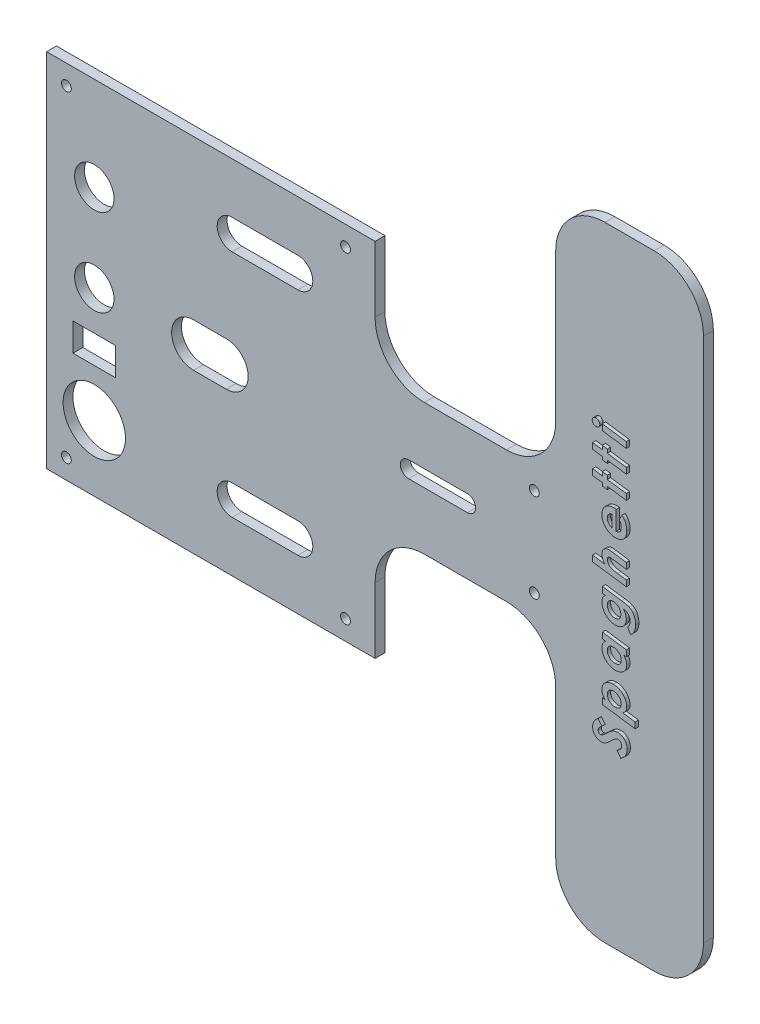
from build123d import *

# Parameters (mm, degrees)
SKETCH1_W           = 155
SKETCH1_H           = 110
BOSS_EXTRUDE1_DEPTH = 3
SKETCH2_R           = 9.5
SKETCH2_R_2         = 6
SKETCH2_R_3         = 1.5
SKETCH2_W           = 55
SKETCH2_H           = 35
SKETCH2_W_2         = 13
SKETCH2_H_2         = 8.5
CUT_EXTRUDE1_DEPTH  = 148
BOSS_EXTRUDE3_DEPTH = 3
FILLET1_R           = 15
CUT_EXTRUDE4_DEPTH  = 98
BOSS_EXTRUDE5_DEPTH = 1


with BuildPart() as part:
    # Sketch1 → Boss-Extrude1 (new body)
    with BuildSketch(Plane.XY):
        Rectangle(SKETCH1_W, SKETCH1_H)
    extrude(amount=BOSS_EXTRUDE1_DEPTH)

    # Sketch2 → Cut-Extrude1 (cut)
    with BuildSketch(Plane.XY.offset(3)):
        with Locations((-63, -35)):
            Circle(SKETCH2_R)
        with Locations((-63, 0)):
            Circle(SKETCH2_R_2)
        with Locations((-63, 26.5)):
            Circle(SKETCH2_R_2)
        with Locations((-71.5, 49)):
            Circle(SKETCH2_R_3)
        with Locations(Location((-71.5, -49, 0), (0, 0, 180))):
            Circle(SKETCH2_R_3)
        with Locations((71, 13.5)):
            Circle(SKETCH2_R_3)
        with Locations(Location((71, -13.5, 0), (0, 0, 180))):
            Circle(SKETCH2_R_3)
        with Locations((13.5, 49)):
            Circle(SKETCH2_R_3)
        with Locations(Location((13.5, -49, 0), (0, 0, 180))):
            Circle(SKETCH2_R_3)
        with Locations((50, -37.5)):
            Rectangle(SKETCH2_W, SKETCH2_H)
        with Locations((50, 37.5)):
            Rectangle(SKETCH2_W, SKETCH2_H)
        with Locations((-63.000064386, -16.25)):
            Rectangle(SKETCH2_W_2, SKETCH2_H_2)
        with BuildLine():
            Line((-21.019359149, 39.556644291), (-1.019359149, 39.556644291))
            ThreePointArc((-1.019359149, 39.556644291), (3.537285142, 35), (-1.019359149, 30.443355709))
            Line((-1.019359149, 30.443355709), (-21.019359149, 30.443355709))
            ThreePointArc((-21.019359149, 30.443355709), (-25.57600344, 35), (-21.019359149, 39.556644291))
        make_face()
        with BuildLine():
            Line((-21.019359149, -39.556644291), (-1.019359149, -39.556644291))
            ThreePointArc((-1.019359149, -39.556644291), (3.537285142, -35), (-1.019359149, -30.443355709))
            Line((-1.019359149, -30.443355709), (-21.019359149, -30.443355709))
            ThreePointArc((-21.019359149, -30.443355709), (-25.57600344, -35), (-21.019359149, -39.556644291))
        make_face()
        with BuildLine():
            Line((32.671689108, 2.5), (50.600051361, 2.5))
            ThreePointArc((50.600051361, 2.5), (53.100051361, 0), (50.600051361, -2.5))
            Line((50.600051361, -2.5), (32.671689108, -2.5))
            ThreePointArc((32.671689108, -2.5), (30.171689108, 0), (32.671689108, 2.5))
        make_face()
    extrude(amount=-CUT_EXTRUDE1_DEPTH, mode=Mode.SUBTRACT)

    # Sketch5 → Boss-Extrude3 (add)
    with BuildSketch(Plane.XY.offset(3)):
        Polygon((77.5, 20), (77.5, 95), (122.5, 95), (122.5, -95), (77.5, -95), (77.5, -20), align=None)
    extrude(amount=-BOSS_EXTRUDE3_DEPTH)

    # Fillet1
    fillet1_edges = [part.edges().sort_by_distance(p)[0] for p in [
        (77.5, -20, 1.5),
        (22.5, -20, 1.5),
        (77.5, -95, 1.5),
        (77.5, 95, 1.5),
        (122.5, 95, 1.5),
        (122.5, -95, 1.5),
        (77.5, 20, 1.5),
        (22.5, 20, 1.5),
    ]]
    fillet(fillet1_edges, radius=FILLET1_R)

    # Sketch9 → Cut-Extrude4 (cut)
    with BuildSketch(Plane.XY.offset(3)):
        with BuildLine():
            Line((-32.795860477, 6.651937297), (-22.795860477, 6.651937297))
            ThreePointArc((-22.795860477, 6.651937297), (-16.143923179, 0), (-22.795860477, -6.651937297))
            Line((-22.795860477, -6.651937297), (-32.795860477, -6.651937297))
            ThreePointArc((-32.795860477, -6.651937297), (-39.447797774, 0), (-32.795860477, 6.651937297))
        make_face()
    extrude(amount=-CUT_EXTRUDE4_DEPTH, mode=Mode.SUBTRACT)

    # Sketch8 → Boss-Extrude5 (add)
    # profile 1 of 10: a face of its own
    with BuildSketch(Plane.XY.offset(3)):
        with BuildLine():
            add(Edge.make_bspline(
                [(89.615384615, 41.935897436), (89.619798289, 42.012422402), (89.628468039, 42.162739898), (89.692001625, 42.379953596), (89.801735818, 42.577887154), (89.948996556, 42.754166087), (90.12609206, 42.901671261), (90.324190957, 43.013060386), (90.542415446, 43.07661064), (90.692714958, 43.085313209), (90.769230769, 43.08974359)],
                knots=[0, 0, 0, 0, 1.013694729, 1.991193998, 2.969534402, 3.993991339, 5.018448277, 6.008806002, 6.986305271, 8, 8, 8, 8], degree=3))
            add(Edge.make_bspline(
                [(90.769230769, 43.08974359), (90.845729295, 43.085282793), (90.995994855, 43.076520479), (91.21390075, 43.01357184), (91.410615409, 42.90097956), (91.587670945, 42.754337612), (91.734312893, 42.577282076), (91.846905173, 42.380567416), (91.909853812, 42.162661521), (91.918616126, 42.012395962), (91.923076923, 41.935897436)],
                knots=[0, 0, 0, 0, 1.014134371, 1.992057583, 2.975098753, 4, 5.024901247, 6.007942417, 6.985865629, 8, 8, 8, 8], degree=3))
            add(Edge.make_bspline(
                [(91.923076923, 41.935897436), (91.918646542, 41.859381625), (91.909943973, 41.709082113), (91.846393719, 41.490857624), (91.735004595, 41.292758727), (91.58749942, 41.115663222), (91.411220487, 40.968402485), (91.213286929, 40.858668292), (90.996073231, 40.795134706), (90.845755735, 40.786464955), (90.769230769, 40.782051282)],
                knots=[0, 0, 0, 0, 1.013694729, 1.991193998, 2.981551723, 4.006008661, 5.030465598, 6.008806002, 6.986305271, 8, 8, 8, 8], degree=3))
            add(Edge.make_bspline(
                [(90.769230769, 40.782051282), (90.692688918, 40.786434767), (90.542338255, 40.795045219), (90.324798393, 40.85917901), (90.125493534, 40.967711391), (89.949165778, 41.115832445), (89.801044724, 41.2921602), (89.692512343, 41.49146506), (89.628378552, 41.709004922), (89.619768101, 41.859355585), (89.615384615, 41.935897436)],
                knots=[0, 0, 0, 0, 1.01324697, 1.990314468, 2.975995575, 4, 5.024004425, 6.009685532, 6.98675303, 8, 8, 8, 8], degree=3))
        make_face()
    # profile 2 of 10: a face of its own
    with BuildSketch(Plane.XY.offset(3)):
        Polygon((92.692307692, 40.665865385), (92.692307692, 42.476762821), (100, 41.439102564), (100, 39.628205128), align=None)
    # profile 3 of 10: a face of its own
    with BuildSketch(Plane.XY.offset(3)):
        Polygon((89.743589744, 34.268429487), (89.743589744, 36.077323718), (92.692307692, 35.668669872), (92.692307692, 36.8125), (94.230769231, 36.596153846), (94.230769231, 35.454326923), (100, 34.655048077), (100, 32.846153846), (94.230769231, 33.645432692), (94.230769231, 32.760016026), (92.692307692, 32.968349359), (92.692307692, 33.859775641), align=None)
    # profile 4 of 10: a face of its own
    with BuildSketch(Plane.XY.offset(3)):
        Polygon((89.743589744, 27.358173077), (89.743589744, 29.167067308), (92.692307692, 28.758413462), (92.692307692, 29.90224359), (94.230769231, 29.685897436), (94.230769231, 28.544070513), (100, 27.744791667), (100, 25.935897436), (94.230769231, 26.735176282), (94.230769231, 25.849759615), (92.692307692, 26.058092949), (92.692307692, 26.949519231), align=None)
    # profile 5 of 10: a face of its own
    with BuildSketch(Plane.XY.offset(3)):
        with BuildLine():
            Line((97.838541667, 19.778846154), (98.643830128, 21.347355769))
            add(Edge.make_bspline(
                [(98.643830128, 21.347355769), (98.754711611, 21.254701788), (98.977583944, 21.068466823), (99.266176914, 20.733534007), (99.522920581, 20.359631097), (99.735884042, 19.942273434), (99.914975676, 19.494970043), (100.036066682, 19.017288598), (100.116342809, 18.517542305), (100.124202932, 18.175939573), (100.128205128, 18.002003205)],
                knots=[0, 0, 0, 0, 0.91429263, 1.837732749, 2.790683283, 3.782328276, 4.800623265, 5.837153557, 6.898727618, 8, 8, 8, 8], degree=3))
            add(Edge.make_bspline(
                [(100.128205128, 18.002003205), (100.125875793, 17.866318786), (100.121341636, 17.602202957), (100.075596812, 17.21704854), (100.004360679, 16.853724494), (99.905219823, 16.511530872), (99.77362944, 16.192210569), (99.613798812, 15.894959166), (99.423120854, 15.620564967), (99.208244387, 15.36816703), (98.966476869, 15.143922168), (98.706346276, 14.946203996), (98.424510251, 14.781406758), (98.125793048, 14.643900829), (97.805978203, 14.540610157), (97.469005701, 14.463735679), (97.111851734, 14.420032968), (96.867770275, 14.413567203), (96.742788462, 14.41025641)],
                knots=[0, 0, 0, 0, 1.167477615, 2.272547723, 3.333260184, 4.35175612, 5.333739381, 6.300721368, 7.250954529, 8.204796535, 9.148260922, 10.083990134, 11.011581413, 11.952960057, 12.90901612, 13.899023909, 14.924196034, 16, 16, 16, 16], degree=3))
            add(Edge.make_bspline(
                [(96.742788462, 14.41025641), (96.599006697, 14.413216679), (96.31622527, 14.419038759), (95.901873414, 14.479965591), (95.503842543, 14.573628103), (95.122175418, 14.705782612), (94.758289438, 14.877457868), (94.410356631, 15.084811674), (94.08205492, 15.333458175), (93.771264937, 15.613294145), (93.48980502, 15.921281105), (93.241143698, 16.24704218), (93.030813439, 16.589647706), (92.861211228, 16.948814321), (92.72657244, 17.32286166), (92.634202584, 17.713347723), (92.572995786, 18.118926813), (92.567091368, 18.395071799), (92.564102564, 18.534855769)],
                knots=[0, 0, 0, 0, 1.055178004, 2.075261378, 3.068364474, 4.054640702, 5.035171133, 6.018236298, 7.023455918, 8.054558162, 9.085333887, 10.082725248, 11.059939622, 12.031602088, 12.994751881, 13.973551994, 14.974216577, 16, 16, 16, 16], degree=3))
            add(Edge.make_bspline(
                [(92.564102564, 18.534855769), (92.565986857, 18.619683728), (92.569701209, 18.786898117), (92.588827572, 19.034678295), (92.626270181, 19.274409992), (92.672500326, 19.507987127), (92.738645195, 19.732595984), (92.813397414, 19.95240065), (92.906490632, 20.163729602), (93.010443277, 20.368978785), (93.127713405, 20.565374092), (93.261914031, 20.749798925), (93.404921764, 20.927036696), (93.563887306, 21.091023731), (93.735066026, 21.243733995), (93.917817641, 21.386198196), (94.112999269, 21.518989955), (94.319637252, 21.640486788), (94.536646724, 21.747535935), (94.757377641, 21.845375442), (94.985642122, 21.921567064), (95.216110319, 21.990023397), (95.453066443, 22.03784768), (95.693239753, 22.078312131), (95.938550572, 22.096714742), (96.103080147, 22.100605605), (96.185897436, 22.102564103)],
                knots=[0, 0, 0, 0, 1.072188589, 2.113517315, 3.137435039, 4.137002117, 5.119903788, 6.093963913, 7.069010391, 8.035106587, 9.000354829, 9.955778878, 10.915218894, 11.876030889, 12.838175907, 13.812126375, 14.80213793, 15.819532818, 16.838431307, 17.858900958, 18.867615473, 19.8771767, 20.89499142, 21.92019484, 22.953113298, 24, 24, 24, 24], degree=3))
            add(Edge.make_bspline(
                [(96.185897436, 22.102564103), (96.24066704, 22.101685307), (96.35499892, 22.099850817), (96.532875992, 22.087687099), (96.723844374, 22.064919034), (96.855024152, 22.044860824), (96.923076923, 22.034455128)],
                knots=[0, 0, 0, 0, 0.886850393, 1.851305573, 2.885311361, 4, 4, 4, 4], degree=3))
            Line((96.923076923, 22.034455128), (96.923076923, 16.205128205))
            add(Edge.make_bspline(
                [(96.923076923, 16.205128205), (96.980577387, 16.208952628), (97.09274753, 16.216413194), (97.256200911, 16.241613689), (97.409711665, 16.284415018), (97.554194758, 16.341044589), (97.691272207, 16.408543154), (97.819170306, 16.491739768), (97.936542521, 16.590135926), (98.045849383, 16.700997906), (98.143505273, 16.824441985), (98.227730232, 16.959988816), (98.301009224, 17.105847893), (98.360448641, 17.263644089), (98.406697354, 17.432666853), (98.437872516, 17.612467226), (98.458934516, 17.803184321), (98.460654382, 17.934501116), (98.461538462, 18.002003205)],
                knots=[0, 0, 0, 0, 1.040684933, 2.030136289, 2.981129354, 3.912883477, 4.829844414, 5.736434864, 6.66145125, 7.591095296, 8.544227486, 9.497969974, 10.46886979, 11.488086259, 12.538510435, 13.629156696, 14.781291649, 16, 16, 16, 16], degree=3))
            add(Edge.make_bspline(
                [(98.461538462, 18.002003205), (98.45940312, 18.084195929), (98.455172119, 18.247053936), (98.42781483, 18.488067881), (98.376354834, 18.721497976), (98.3083946, 18.94794556), (98.222966633, 19.168286274), (98.112543839, 19.378475207), (97.987180423, 19.584727866), (97.888509943, 19.713588906), (97.838541667, 19.778846154)],
                knots=[0, 0, 0, 0, 1.027214308, 2.035339218, 3.025519259, 4.010199041, 4.987959988, 5.973205312, 6.973599434, 8, 8, 8, 8], degree=3))
        make_face()
        with BuildLine():
            add(Edge.make_bspline(
                [(95.641025641, 20.179487179), (95.530936895, 20.143905723), (95.318959264, 20.075393062), (95.031189422, 19.925015224), (94.783632266, 19.743765427), (94.581621724, 19.527007326), (94.423436776, 19.282686335), (94.312655282, 19.012227288), (94.241762675, 18.718771836), (94.234500505, 18.513910705), (94.230769231, 18.408653846)],
                knots=[0, 0, 0, 0, 1.131097592, 2.177946407, 3.163839296, 4.121316581, 5.062495572, 5.997386602, 6.971064957, 8, 8, 8, 8], degree=3))
            add(Edge.make_bspline(
                [(94.230769231, 18.408653846), (94.235602279, 18.303473703), (94.245126324, 18.096204841), (94.314576051, 17.793099303), (94.433780785, 17.507876362), (94.593384692, 17.238178291), (94.798533971, 16.994234496), (95.042887654, 16.779082452), (95.324894681, 16.594952708), (95.534033434, 16.502715831), (95.641025641, 16.455528846)],
                knots=[0, 0, 0, 0, 0.984248377, 1.939567998, 2.892594423, 3.868130085, 4.862155317, 5.862996802, 6.90674164, 8, 8, 8, 8], degree=3))
            Line((95.641025641, 16.455528846), (95.641025641, 20.179487179))
        make_face(mode=Mode.SUBTRACT)
    # profile 6 of 10: a face of its own
    with BuildSketch(Plane.XY.offset(3)):
        with BuildLine():
            Line((89.743589744, 4.579326923), (89.743589744, 6.390224359))
            Line((89.743589744, 6.390224359), (93.497596154, 5.86338141))
            add(Edge.make_bspline(
                [(93.497596154, 5.86338141), (93.423403914, 5.950409266), (93.27802206, 6.120942884), (93.088786103, 6.389604837), (92.925942796, 6.659110179), (92.795241903, 6.933130218), (92.69304333, 7.209520582), (92.617551893, 7.488104608), (92.571864695, 7.76957754), (92.56668662, 7.958570152), (92.564102564, 8.052884615)],
                knots=[0, 0, 0, 0, 1.127033968, 2.208455877, 3.235925819, 4.228310071, 5.196911126, 6.137542718, 7.070563353, 8, 8, 8, 8], degree=3))
            add(Edge.make_bspline(
                [(92.564102564, 8.052884615), (92.566321318, 8.13240288), (92.570658984, 8.287861125), (92.595912099, 8.515413542), (92.642648214, 8.731181971), (92.706930948, 8.936366512), (92.788335178, 9.13190624), (92.891805144, 9.314020585), (93.010625817, 9.486679416), (93.148096011, 9.645398661), (93.300095857, 9.789221633), (93.46212598, 9.915903445), (93.634206591, 10.022937689), (93.815035913, 10.111909623), (94.006618316, 10.180213847), (94.20746428, 10.227991384), (94.417588236, 10.256447943), (94.560541961, 10.260403502), (94.633413462, 10.262419872)],
                knots=[0, 0, 0, 0, 1.125366301, 2.200091673, 3.234176302, 4.244240654, 5.239255823, 6.224895753, 7.202532568, 8.20072778, 9.189893838, 10.159461482, 11.105918676, 12.05247019, 13.005835065, 13.977518165, 14.969028007, 16, 16, 16, 16], degree=3))
            add(Edge.make_bspline(
                [(94.633413462, 10.262419872), (94.712225008, 10.260241096), (94.887389641, 10.255398601), (95.1756149, 10.235397323), (95.514463055, 10.194709657), (95.757245081, 10.163153659), (95.887419872, 10.146233974)],
                knots=[0, 0, 0, 0, 0.750738588, 1.668573403, 2.749936422, 4, 4, 4, 4], degree=3))
            Line((95.887419872, 10.146233974), (100, 9.567307692))
            Line((100, 9.567307692), (100, 7.756410256))
            Line((100, 7.756410256), (95.977564103, 8.323317308))
            add(Edge.make_bspline(
                [(95.977564103, 8.323317308), (95.886126961, 8.335648129), (95.716132388, 8.358572868), (95.478526797, 8.386028091), (95.277268233, 8.399985328), (95.154927396, 8.403759273), (95.100160256, 8.405448718)],
                knots=[0, 0, 0, 0, 1.255620443, 2.33437593, 3.254366179, 4, 4, 4, 4], degree=3))
            add(Edge.make_bspline(
                [(95.100160256, 8.405448718), (95.034452194, 8.402578357), (94.90843322, 8.397073402), (94.730195834, 8.349591745), (94.578128899, 8.264143366), (94.448762072, 8.150943397), (94.349482184, 8.004345298), (94.279591763, 7.830259592), (94.237727038, 7.629494926), (94.233166956, 7.48685836), (94.230769231, 7.411858974)],
                knots=[0, 0, 0, 0, 1.050101368, 2.013949141, 2.917449672, 3.817661976, 4.738976116, 5.720704297, 6.801529067, 8, 8, 8, 8], degree=3))
            add(Edge.make_bspline(
                [(94.230769231, 7.411858974), (94.233990325, 7.334030694), (94.2405217, 7.176219232), (94.302999955, 6.942291177), (94.398684651, 6.708796373), (94.529747936, 6.479267706), (94.693808696, 6.261444289), (94.893082776, 6.069938834), (95.120021576, 5.904121708), (95.334550907, 5.787365229), (95.532140669, 5.706305471), (95.71157359, 5.646517595), (95.920596905, 5.589557271), (96.158238234, 5.531324964), (96.425765769, 5.476145416), (96.722098406, 5.419658029), (97.048114124, 5.366014429), (97.275577665, 5.333440671), (97.393830128, 5.31650641)],
                knots=[0, 0, 0, 0, 0.89214371, 1.808989007, 2.761593995, 3.78495755, 4.835480972, 5.882051196, 6.946419473, 8.054682445, 8.676960472, 9.397126307, 10.225005564, 11.164184155, 12.206363156, 13.361335832, 14.628226152, 16, 16, 16, 16], degree=3))
            Line((97.393830128, 5.31650641), (100, 4.951923077))
            Line((100, 4.951923077), (100, 3.141025641))
            Line((100, 3.141025641), (89.743589744, 4.579326923))
        make_face()
    # profile 7 of 10: a face of its own
    with BuildSketch(Plane.XY.offset(3)):
        with BuildLine():
            Line((92.692307692, -2.21875), (92.692307692, -0.407852564))
            Line((92.692307692, -0.407852564), (98.551682692, -1.243189103))
            add(Edge.make_bspline(
                [(98.551682692, -1.243189103), (98.688623066, -1.26284698), (98.950091167, -1.300380892), (99.324267574, -1.360087081), (99.662071153, -1.4222997), (99.964180851, -1.483444602), (100.229960808, -1.545966746), (100.459868074, -1.606265539), (100.653988765, -1.6697918), (100.768815311, -1.717960984), (100.821314103, -1.739983974)],
                knots=[0, 0, 0, 0, 1.425557641, 2.721898884, 3.90413036, 4.964777991, 5.897734604, 6.717254701, 7.413527788, 8, 8, 8, 8], degree=3))
            add(Edge.make_bspline(
                [(100.821314103, -1.739983974), (100.891993809, -1.774982052), (101.033616368, -1.845108506), (101.236429541, -1.969831542), (101.429563063, -2.113191066), (101.613573968, -2.273431506), (101.788278539, -2.450266571), (101.953201083, -2.644055838), (102.109786513, -2.854442679), (102.255167643, -3.082941867), (102.390543701, -3.325559171), (102.503565705, -3.586076622), (102.602906168, -3.859272657), (102.68251761, -4.148731761), (102.744496544, -4.453294922), (102.787378813, -4.773234027), (102.817256737, -5.107473588), (102.819413862, -5.335668213), (102.820512821, -5.451923077)],
                knots=[0, 0, 0, 0, 0.848836039, 1.700832358, 2.559234755, 3.435720172, 4.325345191, 5.233000611, 6.173349811, 7.146542502, 8.147176572, 9.161074506, 10.200321598, 11.274755114, 12.389998816, 13.543961912, 14.748759421, 16, 16, 16, 16], degree=3))
            add(Edge.make_bspline(
                [(102.820512821, -5.451923077), (102.819763927, -5.548796968), (102.818284744, -5.740138381), (102.794393832, -6.022123182), (102.761545935, -6.295110921), (102.713384717, -6.558017773), (102.651072212, -6.811513701), (102.575249615, -7.055853002), (102.485173892, -7.290872159), (102.380768864, -7.514384765), (102.266953831, -7.726330934), (102.144889807, -7.925268838), (102.013766518, -8.110073778), (101.876879363, -8.282790102), (101.72882617, -8.439434728), (101.575699453, -8.584339495), (101.412063059, -8.713338736), (101.297282441, -8.789369281), (101.239983974, -8.827323718)],
                knots=[0, 0, 0, 0, 1.19551444, 2.361332028, 3.491126619, 4.588953787, 5.65856574, 6.711885877, 7.74521166, 8.763100454, 9.75519518, 10.713744266, 11.642299174, 12.551180331, 13.431810988, 14.300790523, 15.151754888, 16, 16, 16, 16], degree=3))
            Line((101.239983974, -8.827323718), (100.442708333, -7.250801282))
            add(Edge.make_bspline(
                [(100.442708333, -7.250801282), (100.499450378, -7.190498962), (100.611880609, -7.071014304), (100.756682306, -6.872551426), (100.879681345, -6.661149512), (100.980240145, -6.435430452), (101.05796693, -6.196303908), (101.114813592, -5.944292736), (101.146112758, -5.679074355), (101.151235825, -5.498073673), (101.153846154, -5.405849359)],
                knots=[0, 0, 0, 0, 0.977550395, 1.936944955, 2.894976139, 3.862639267, 4.850608126, 5.861218119, 6.91023786, 8, 8, 8, 8], degree=3))
            add(Edge.make_bspline(
                [(101.153846154, -5.405849359), (101.151482003, -5.299512022), (101.146880537, -5.092542343), (101.102013722, -4.794343451), (101.030541221, -4.517516422), (100.927742903, -4.265202463), (100.802053203, -4.036513915), (100.654772287, -3.833012485), (100.484876236, -3.657874666), (100.292255272, -3.504170491), (100.062636225, -3.378044326), (99.789858406, -3.275445081), (99.471321105, -3.189233117), (99.240585651, -3.153243435), (99.118589744, -3.134214744)],
                knots=[0, 0, 0, 0, 1.122521283, 2.184819325, 3.177070976, 4.135793031, 5.054451157, 5.927691721, 6.780644378, 7.624420347, 8.52115684, 9.534933171, 10.696654294, 12, 12, 12, 12], degree=3))
            add(Edge.make_bspline(
                [(99.118589744, -3.134214744), (99.188705562, -3.217955834), (99.3269731, -3.383092241), (99.508690027, -3.646110225), (99.657893249, -3.919924574), (99.784673467, -4.199661424), (99.879803061, -4.489469771), (99.951402904, -4.786621675), (99.991404768, -5.092922425), (99.997117405, -5.299571247), (100, -5.403846154)],
                knots=[0, 0, 0, 0, 1.052149334, 2.074825641, 3.074159448, 4.053489491, 5.030173692, 6.008742465, 6.995212311, 8, 8, 8, 8], degree=3))
            add(Edge.make_bspline(
                [(100, -5.403846154), (99.995506952, -5.548505938), (99.986611977, -5.834891748), (99.899859321, -6.254754883), (99.766402173, -6.658802595), (99.577007343, -7.040785822), (99.342080168, -7.396041103), (99.058636726, -7.712855948), (98.732447033, -7.990829287), (98.364395476, -8.223437279), (97.963643526, -8.409729645), (97.538317415, -8.544232324), (97.090582383, -8.627356993), (96.784551878, -8.636411614), (96.628605769, -8.641025641)],
                knots=[0, 0, 0, 0, 0.996953255, 1.973687906, 2.94545508, 3.926223512, 4.906299142, 5.875441628, 6.849401536, 7.853990328, 8.870175519, 9.890124044, 10.924855725, 12, 12, 12, 12], degree=3))
            add(Edge.make_bspline(
                [(96.628605769, -8.641025641), (96.539697693, -8.639939564), (96.362759642, -8.637778137), (96.10025423, -8.606424673), (95.840490341, -8.567089759), (95.586274813, -8.502661526), (95.334721705, -8.426696739), (95.090454814, -8.325258289), (94.846370837, -8.215040105), (94.610442518, -8.08255279), (94.381455815, -7.93637764), (94.16380126, -7.776693606), (93.957867136, -7.603805721), (93.76678825, -7.416226408), (93.582456821, -7.220954534), (93.415042381, -7.009206428), (93.257528739, -6.786426108), (93.11542046, -6.551246018), (92.984569274, -6.310056517), (92.872550061, -6.063568942), (92.778160071, -5.813802356), (92.699464224, -5.56184488), (92.639883843, -5.306576317), (92.595067063, -5.04922211), (92.56833895, -4.788767542), (92.565516176, -4.613975925), (92.564102564, -4.526442308)],
                knots=[0, 0, 0, 0, 0.998920008, 1.987974178, 2.9691619, 3.950579356, 4.933603435, 5.920604085, 6.92155316, 7.943122993, 8.959382773, 9.974421754, 10.976018137, 11.979441612, 12.983426599, 13.992897884, 15.011373551, 16.049117865, 17.080269802, 18.094864491, 19.09039353, 20.080586705, 21.060251088, 22.035273375, 23.016087667, 24, 24, 24, 24], degree=3))
            add(Edge.make_bspline(
                [(92.564102564, -4.526442308), (92.566311993, -4.422742683), (92.57066829, -4.218279668), (92.61941071, -3.92065045), (92.690396904, -3.635819184), (92.795459155, -3.363971006), (92.93937899, -3.102130246), (93.119367962, -2.843836036), (93.34047582, -2.589535643), (93.510107443, -2.430916917), (93.59775641, -2.348958333)],
                knots=[0, 0, 0, 0, 0.997380049, 1.966519485, 2.895738586, 3.819695473, 4.763146755, 5.765300517, 6.845326728, 8, 8, 8, 8], degree=3))
            Line((93.59775641, -2.348958333), (92.692307692, -2.21875))
        make_face()
        with BuildLine():
            add(Edge.make_bspline(
                [(94.230769231, -4.518429487), (94.23240691, -4.598683782), (94.235627776, -4.756521944), (94.269668016, -4.988369207), (94.320130459, -5.211032643), (94.3956443, -5.42365942), (94.491909509, -5.626244126), (94.609537518, -5.81951496), (94.745088245, -6.004929419), (94.903974611, -6.175708729), (95.075711752, -6.332526), (95.259895495, -6.470595652), (95.453939641, -6.586734776), (95.658239429, -6.681378554), (95.871318076, -6.756526641), (96.094554169, -6.807289807), (96.327075344, -6.841382677), (96.485583353, -6.844541284), (96.56650641, -6.846153846)],
                knots=[0, 0, 0, 0, 1.046811451, 2.058790701, 3.052437673, 4.022760614, 4.99741895, 5.974995723, 6.972115194, 7.989932835, 9.014186185, 10.004310117, 10.989357247, 11.960306304, 12.938853955, 13.932500926, 14.944480177, 16, 16, 16, 16], degree=3))
            add(Edge.make_bspline(
                [(96.56650641, -6.846153846), (96.632044675, -6.844804575), (96.759578207, -6.842178973), (96.945592716, -6.816218573), (97.122322129, -6.780661403), (97.287752128, -6.722212769), (97.444997764, -6.653149771), (97.591164063, -6.566563982), (97.727852284, -6.464895507), (97.852453759, -6.347647709), (97.965552138, -6.216892684), (98.062779885, -6.074334601), (98.148752298, -5.923132953), (98.216951297, -5.759623442), (98.267786764, -5.585290676), (98.306917454, -5.40130027), (98.328355492, -5.206704673), (98.331649549, -5.073365683), (98.333333333, -5.005208333)],
                knots=[0, 0, 0, 0, 1.092070465, 2.125103607, 3.127500323, 4.092273583, 5.044175292, 5.987507913, 6.9183385, 7.879378053, 8.834659921, 9.795183341, 10.75228035, 11.730389622, 12.741406616, 13.776477892, 14.863427915, 16, 16, 16, 16], degree=3))
            add(Edge.make_bspline(
                [(98.333333333, -5.005208333), (98.330366379, -4.902060961), (98.324498792, -4.698071918), (98.262421183, -4.398974426), (98.169768499, -4.110633959), (98.035640782, -3.838250546), (97.871881174, -3.582705793), (97.667536277, -3.356911414), (97.434351681, -3.156482682), (97.1692461, -2.990046654), (96.884980764, -2.854336925), (96.585838836, -2.754817579), (96.275060627, -2.695340051), (96.063955505, -2.687464071), (95.957532051, -2.68349359)],
                knots=[0, 0, 0, 0, 1.001779676, 1.981166104, 2.958677653, 3.940365058, 4.925611565, 5.900660919, 6.891009212, 7.907063277, 8.935350078, 9.947765901, 10.965416672, 12, 12, 12, 12], degree=3))
            add(Edge.make_bspline(
                [(95.957532051, -2.68349359), (95.89668492, -2.684969266), (95.777171147, -2.687867737), (95.602049215, -2.712584523), (95.434830755, -2.752385152), (95.275780461, -2.808939102), (95.123852304, -2.880836616), (94.98199352, -2.972957205), (94.844866981, -3.076101846), (94.718808741, -3.196677168), (94.605941991, -3.330454998), (94.504808582, -3.472544219), (94.420281487, -3.624630116), (94.349474121, -3.785265846), (94.295807076, -3.955995844), (94.257518932, -4.135723193), (94.235747404, -4.324248914), (94.232448252, -4.452936922), (94.230769231, -4.518429487)],
                knots=[0, 0, 0, 0, 1.034386109, 2.031704437, 3.001222957, 3.953022077, 4.897749581, 5.852322152, 6.82443093, 7.812395539, 8.811328854, 9.79746438, 10.773610805, 11.765223455, 12.778003015, 13.811453677, 14.886193699, 16, 16, 16, 16], degree=3))
        make_face(mode=Mode.SUBTRACT)
    # profile 8 of 10: a face of its own
    with BuildSketch(Plane.XY.offset(3)):
        with BuildLine():
            Line((92.692307692, -14.257211538), (92.692307692, -12.444310897))
            Line((92.692307692, -12.444310897), (100, -13.481971154))
            Line((100, -13.481971154), (100, -15.294871795))
            Line((100, -15.294871795), (99.106570513, -15.168669872))
            add(Edge.make_bspline(
                [(99.106570513, -15.168669872), (99.196140226, -15.262870321), (99.36693378, -15.442493867), (99.58919504, -15.719798482), (99.766822795, -15.988801294), (99.905750314, -16.251965176), (100.005159082, -16.519820534), (100.07798752, -16.796671838), (100.120580205, -17.090427333), (100.125620759, -17.291260533), (100.128205128, -17.394230769)],
                knots=[0, 0, 0, 0, 1.23662072, 2.358016352, 3.3766974, 4.300377131, 5.183175598, 6.089423761, 7.020418501, 8, 8, 8, 8], degree=3))
            add(Edge.make_bspline(
                [(100.128205128, -17.394230769), (100.125462758, -17.511947404), (100.12009197, -17.742489225), (100.068118489, -18.078786106), (99.986833076, -18.396706519), (99.872136873, -18.696400176), (99.722425741, -18.976247732), (99.540939992, -19.238928434), (99.325445512, -19.482066889), (99.078792741, -19.70232855), (98.81294816, -19.900970892), (98.532028148, -20.073749674), (98.242605365, -20.223776723), (97.939392366, -20.340549592), (97.628059838, -20.436944452), (97.304455528, -20.501474768), (96.970902855, -20.543101508), (96.744918072, -20.548534101), (96.630608974, -20.551282051)],
                knots=[0, 0, 0, 0, 1.072254913, 2.099954687, 3.093402483, 4.05863531, 5.017013142, 5.979305845, 6.962352722, 7.970695896, 8.988290287, 9.983079422, 10.973839091, 11.95483031, 12.940586347, 13.940815436, 14.958409826, 16, 16, 16, 16], degree=3))
            add(Edge.make_bspline(
                [(96.630608974, -20.551282051), (96.542403646, -20.549903354), (96.366936227, -20.547160702), (96.105207358, -20.520068294), (95.847038743, -20.475934109), (95.591591895, -20.415285301), (95.338868395, -20.33981247), (95.089466906, -20.244776452), (94.843513175, -20.132512531), (94.602195423, -20.004545842), (94.368128707, -19.863934526), (94.148495185, -19.706935337), (93.940710818, -19.540181677), (93.746147564, -19.361353762), (93.564036332, -19.172007106), (93.396149617, -18.969683114), (93.243047252, -18.755237799), (93.10025735, -18.532100866), (92.975721458, -18.300245255), (92.863863827, -18.065708693), (92.77266314, -17.826744925), (92.695464838, -17.586350444), (92.637491664, -17.342434226), (92.595820561, -17.096186066), (92.56816565, -16.847316835), (92.565458315, -16.680494619), (92.564102564, -16.596955128)],
                knots=[0, 0, 0, 0, 1.010804525, 2.010799866, 3.012434256, 4.0112572, 5.018578185, 6.033576038, 7.068012393, 8.115729333, 9.163250544, 10.195390638, 11.207874578, 12.215486318, 13.222400104, 14.217108778, 15.226114975, 16.241112828, 17.251482568, 18.241024349, 19.217544296, 20.180988025, 21.13336189, 22.088438575, 23.042748192, 24, 24, 24, 24], degree=3))
            add(Edge.make_bspline(
                [(92.564102564, -16.596955128), (92.567267742, -16.485858248), (92.573506762, -16.266870352), (92.63199282, -15.946130548), (92.724495044, -15.638867819), (92.852771815, -15.345842739), (93.0162248, -15.070656443), (93.217565051, -14.821344848), (93.448347343, -14.592274688), (93.627118546, -14.467063091), (93.717948718, -14.403445513)],
                knots=[0, 0, 0, 0, 1.030509072, 2.031281277, 3.015697838, 4.003854478, 4.993584726, 5.977161716, 6.972235198, 8, 8, 8, 8], degree=3))
            Line((93.717948718, -14.403445513), (92.692307692, -14.257211538))
        make_face()
        with BuildLine():
            add(Edge.make_bspline(
                [(98.461538462, -16.991586538), (98.458011329, -16.887225962), (98.451136793, -16.683822636), (98.399540108, -16.388622507), (98.307692434, -16.115591113), (98.183260174, -15.861246479), (98.017647621, -15.628111752), (97.813769833, -15.413401565), (97.565003568, -15.22364757), (97.284961999, -15.054371014), (96.98349315, -14.913879094), (96.672463895, -14.810758188), (96.357595189, -14.745038142), (96.145477139, -14.737656595), (96.039663462, -14.733974359)],
                knots=[0, 0, 0, 0, 1.01777374, 1.983685499, 2.91055289, 3.819370874, 4.735557804, 5.689203589, 6.696334198, 7.777630447, 8.876247219, 9.932878053, 10.968829974, 12, 12, 12, 12], degree=3))
            add(Edge.make_bspline(
                [(96.039663462, -14.733974359), (95.973503515, -14.735658454), (95.843484681, -14.738968072), (95.65361916, -14.760602287), (95.473759662, -14.798633489), (95.304019237, -14.853202865), (95.144208328, -14.922902968), (94.993883971, -15.008268264), (94.85400418, -15.108013667), (94.725042085, -15.222864922), (94.610036528, -15.350166946), (94.508134677, -15.488099207), (94.422513126, -15.636042265), (94.351606003, -15.793637385), (94.297315845, -15.960920726), (94.260232097, -16.13829074), (94.23494337, -16.32513384), (94.232181297, -16.453304771), (94.230769231, -16.518830128)],
                knots=[0, 0, 0, 0, 1.109290507, 2.17999962, 3.198880738, 4.186717557, 5.164350494, 6.116982533, 7.080083371, 8.039598443, 9.006595861, 9.951565502, 10.909773332, 11.866934082, 12.844118167, 13.852052898, 14.901896093, 16, 16, 16, 16], degree=3))
            add(Edge.make_bspline(
                [(94.230769231, -16.518830128), (94.232433667, -16.59508213), (94.235719479, -16.745613472), (94.269655596, -16.966817472), (94.320326384, -17.180169343), (94.396152931, -17.383603402), (94.48961075, -17.57924225), (94.607688454, -17.764043839), (94.744508074, -17.941601128), (94.901368556, -18.108144335), (95.074930028, -18.260052493), (95.262166468, -18.393004588), (95.462010196, -18.506145369), (95.674148717, -18.598336179), (95.899491148, -18.668135902), (96.135125651, -18.720655852), (96.384095047, -18.750905012), (96.553738128, -18.754545626), (96.640625, -18.756410256)],
                knots=[0, 0, 0, 0, 0.994897251, 1.964056203, 2.915642991, 3.853470011, 4.79324038, 5.741466074, 6.711095529, 7.716481674, 8.723680824, 9.71796663, 10.70964959, 11.717112863, 12.731868792, 13.785363818, 14.865719672, 16, 16, 16, 16], degree=3))
            add(Edge.make_bspline(
                [(96.640625, -18.756410256), (96.707442899, -18.754696785), (96.83811085, -18.751345951), (97.029583368, -18.730256979), (97.210279598, -18.689241602), (97.381259965, -18.635214846), (97.542568502, -18.567882169), (97.692315747, -18.481944106), (97.833210143, -18.381981895), (97.962476052, -18.265453822), (98.080416073, -18.138963228), (98.18164345, -18.000577177), (98.267397476, -17.85393942), (98.341210659, -17.699321271), (98.394537969, -17.534025333), (98.431969967, -17.360810153), (98.457380893, -17.179294298), (98.460131456, -17.055110637), (98.461538462, -16.991586538)],
                knots=[0, 0, 0, 0, 1.124727045, 2.199497152, 3.235615687, 4.237904247, 5.214794901, 6.171040091, 7.137793784, 8.116815346, 9.095062569, 10.043616297, 10.995758263, 11.951012353, 12.921221894, 13.911020586, 14.931417113, 16, 16, 16, 16], degree=3))
        make_face(mode=Mode.SUBTRACT)
    # profile 9 of 10: a face of its own
    with BuildSketch(Plane.XY.offset(3)):
        with BuildLine():
            Line((102.692307692, -31.153445513), (102.692307692, -32.966346154))
            Line((102.692307692, -32.966346154), (92.692307692, -31.552083333))
            Line((92.692307692, -31.552083333), (92.692307692, -29.739182692))
            Line((92.692307692, -29.739182692), (93.58974359, -29.865384615))
            add(Edge.make_bspline(
                [(93.58974359, -29.865384615), (93.498576769, -29.772084144), (93.324714232, -29.594152562), (93.102842892, -29.316501118), (92.920655059, -29.051637294), (92.782622193, -28.789452509), (92.682301992, -28.523471833), (92.615379972, -28.24612141), (92.571505006, -27.954387834), (92.566606266, -27.754171621), (92.564102564, -27.651842949)],
                knots=[0, 0, 0, 0, 1.243808649, 2.372044179, 3.386243404, 4.306628469, 5.191676891, 6.090918287, 7.024285818, 8, 8, 8, 8], degree=3))
            add(Edge.make_bspline(
                [(92.564102564, -27.651842949), (92.56682118, -27.534125794), (92.572130187, -27.304243707), (92.624109461, -26.969239242), (92.705906786, -26.652838999), (92.819672486, -26.354096322), (92.969975282, -26.075809264), (93.151402401, -25.815092522), (93.366959764, -25.574016588), (93.613489986, -25.355589709), (93.88000606, -25.159370763), (94.159286244, -24.986406249), (94.44869182, -24.838303255), (94.750859875, -24.721396904), (95.061674291, -24.625657879), (95.38365728, -24.559891974), (95.716216495, -24.521618038), (95.941406867, -24.515782168), (96.055689103, -24.512820513)],
                knots=[0, 0, 0, 0, 1.075981981, 2.101214428, 3.092205112, 4.060793008, 5.017115511, 5.977738038, 6.959635225, 7.967401889, 8.984892487, 9.983139427, 10.969130554, 11.953531617, 12.942714059, 13.94043777, 14.954789346, 16, 16, 16, 16], degree=3))
            add(Edge.make_bspline(
                [(96.055689103, -24.512820513), (96.143903579, -24.514143144), (96.319389199, -24.516774263), (96.580873346, -24.544685099), (96.840090903, -24.585746241), (97.096071375, -24.646709399), (97.349500373, -24.722122807), (97.598318489, -24.817808174), (97.845282945, -24.927131395), (98.086143328, -25.055549215), (98.319911568, -25.196831361), (98.541685894, -25.351130541), (98.751971496, -25.51528093), (98.945459227, -25.694141011), (99.126859045, -25.883373811), (99.295623089, -26.083546833), (99.449880662, -26.297091262), (99.591359133, -26.519700155), (99.717200593, -26.75016792), (99.827968087, -26.983911998), (99.919232115, -27.220758717), (99.997564858, -27.458836009), (100.054224525, -27.700418779), (100.09658147, -27.943836787), (100.124192609, -28.189400951), (100.126862666, -28.354227328), (100.128205128, -28.437099359)],
                knots=[0, 0, 0, 0, 1.013862427, 2.01688297, 3.020285397, 4.029603162, 5.039971509, 6.05803995, 7.092448149, 8.143334658, 9.194024848, 10.231164462, 11.24792945, 12.258589433, 13.257694614, 14.260333126, 15.266170323, 16.284238764, 17.290925275, 18.283460634, 19.255777839, 20.207509385, 21.162764386, 22.105598432, 23.047525591, 24, 24, 24, 24], degree=3))
            add(Edge.make_bspline(
                [(100.128205128, -28.437099359), (100.124326792, -28.547535506), (100.116679532, -28.765292252), (100.056524044, -29.085855001), (99.958181348, -29.393351462), (99.821639613, -29.686168332), (99.649149662, -29.961058505), (99.437262467, -30.209528476), (99.190866282, -30.433921099), (99.003586768, -30.55629567), (98.908253205, -30.618589744)],
                knots=[0, 0, 0, 0, 1.012854938, 1.997135925, 2.981512265, 3.968364548, 4.954303361, 5.949886088, 6.956401266, 8, 8, 8, 8], degree=3))
            Line((98.908253205, -30.618589744), (102.692307692, -31.153445513))
        make_face()
        with BuildLine():
            add(Edge.make_bspline(
                [(94.230769231, -28.056490385), (94.234251444, -28.158874054), (94.241058281, -28.359007956), (94.293680392, -28.649646068), (94.382300447, -28.921528325), (94.507651748, -29.173911338), (94.668887735, -29.408120937), (94.874381374, -29.616983873), (95.113380031, -29.811184876), (95.389505939, -29.977498596), (95.685109326, -30.115595934), (95.989405443, -30.220018473), (96.298212223, -30.282201378), (96.505473765, -30.290127668), (96.608573718, -30.294070513)],
                knots=[0, 0, 0, 0, 1.013038613, 1.980231532, 2.912462908, 3.834729153, 4.760682964, 5.714320046, 6.724919081, 7.801840553, 8.895947491, 9.949408453, 10.979956009, 12, 12, 12, 12], degree=3))
            add(Edge.make_bspline(
                [(96.608573718, -30.294070513), (96.676745, -30.292459914), (96.80944771, -30.289324712), (97.003844435, -30.266954892), (97.187899285, -30.22987342), (97.36173924, -30.174425139), (97.525880125, -30.107249097), (97.679881116, -30.024373513), (97.823054859, -29.925685434), (97.954293899, -29.811179604), (98.074957005, -29.686579367), (98.177333278, -29.548166961), (98.266240699, -29.401782431), (98.338710259, -29.24538521), (98.392653377, -29.078277868), (98.432526999, -28.902704266), (98.457219236, -28.716907982), (98.460077129, -28.590087692), (98.461538462, -28.525240385)],
                knots=[0, 0, 0, 0, 1.133447026, 2.206376181, 3.249473249, 4.250346431, 5.23601402, 6.194861297, 7.152743712, 8.12105942, 9.087080537, 10.030894272, 10.977317035, 11.931201, 12.889791075, 13.891833825, 14.922026593, 16, 16, 16, 16], degree=3))
            add(Edge.make_bspline(
                [(98.461538462, -28.525240385), (98.459874489, -28.449654903), (98.456589831, -28.300450257), (98.422652403, -28.081241445), (98.371976785, -27.86987639), (98.296137278, -27.668447117), (98.20267274, -27.474788767), (98.084551601, -27.292039595), (97.947838976, -27.11634028), (97.790191046, -26.952056672), (97.618116796, -26.799673372), (97.429388672, -26.669558436), (97.231384245, -26.555670125), (97.018726147, -26.466583705), (96.796160339, -26.392930314), (96.559563831, -26.343910747), (96.311581978, -26.313197531), (96.141920287, -26.309547466), (96.055689103, -26.307692308)],
                knots=[0, 0, 0, 0, 0.991557118, 1.957319399, 2.905576389, 3.840283823, 4.777290461, 5.723275591, 6.691263317, 7.695756344, 8.70844012, 9.703092477, 10.70017557, 11.701603775, 12.724555837, 13.773361612, 14.868302772, 16, 16, 16, 16], degree=3))
            add(Edge.make_bspline(
                [(96.055689103, -26.307692308), (95.988856488, -26.309337189), (95.858159758, -26.31255389), (95.667033947, -26.33458695), (95.486356927, -26.371974893), (95.315530945, -26.427332554), (95.154319863, -26.496655621), (95.002191393, -26.581360976), (94.861799817, -26.682294179), (94.73176634, -26.796444017), (94.613431995, -26.921894087), (94.511281892, -27.058677459), (94.424321675, -27.203550513), (94.354175718, -27.35768319), (94.296988277, -27.519522657), (94.260564303, -27.691341472), (94.234862184, -27.870755074), (94.232154554, -27.993625418), (94.230769231, -28.056490385)],
                knots=[0, 0, 0, 0, 1.129137786, 2.208122722, 3.245915467, 4.241387565, 5.236923595, 6.206746901, 7.177291825, 8.152677403, 9.126495676, 10.0854959, 11.0316679, 11.975684914, 12.942616357, 13.925282974, 14.938498809, 16, 16, 16, 16], degree=3))
        make_face(mode=Mode.SUBTRACT)
    # profile 10 of 10: a face of its own
    with BuildSketch(Plane.XY.offset(3)):
        with BuildLine():
            Line((91.390224359, -35.916266026), (92.602163462, -37.306490385))
            add(Edge.make_bspline(
                [(92.602163462, -37.306490385), (92.50830654, -37.3759705), (92.32843148, -37.509127861), (92.087170554, -37.720421268), (91.877517717, -37.922848111), (91.710328585, -38.126750377), (91.577757282, -38.325497032), (91.481725345, -38.520819996), (91.421040694, -38.713817199), (91.413780688, -38.842554295), (91.41025641, -38.905048077)],
                knots=[0, 0, 0, 0, 1.358515141, 2.603569235, 3.730126198, 4.746094498, 5.666493297, 6.504166865, 7.273866877, 8, 8, 8, 8], degree=3))
            add(Edge.make_bspline(
                [(91.41025641, -38.905048077), (91.412823334, -38.964070692), (91.417759871, -39.077579046), (91.459508634, -39.240644636), (91.527306013, -39.387983146), (91.622397216, -39.516360838), (91.735296313, -39.622640479), (91.862736504, -39.700370136), (92.002112246, -39.74688011), (92.098344571, -39.753190907), (92.147435897, -39.756410256)],
                knots=[0, 0, 0, 0, 1.129837576, 2.172828228, 3.203495929, 4.21975918, 5.215917372, 6.157552582, 7.06010598, 8, 8, 8, 8], degree=3))
            add(Edge.make_bspline(
                [(92.147435897, -39.756410256), (92.195777125, -39.753437901), (92.297453317, -39.74718614), (92.451112789, -39.702048178), (92.612602952, -39.632320198), (92.753272093, -39.548879918), (92.883210143, -39.458070347), (93.007111315, -39.357601689), (93.159192714, -39.232757567), (93.335161033, -39.076531947), (93.539451002, -38.895678565), (93.768206799, -38.68359466), (94.023351936, -38.444615004), (94.201521052, -38.274846647), (94.294871795, -38.185897436)],
                knots=[0, 0, 0, 0, 0.642375858, 1.351110335, 2.114843505, 2.978399569, 3.520371734, 4.222117927, 5.098724586, 6.137079328, 7.350916393, 8.727204589, 10.285236573, 12, 12, 12, 12], degree=3))
            add(Edge.make_bspline(
                [(94.294871795, -38.185897436), (94.344785461, -38.137646047), (94.440560089, -38.045061007), (94.580435797, -37.91515193), (94.710074016, -37.799205409), (94.824934355, -37.692153211), (94.930947419, -37.600509677), (95.025569795, -37.522263391), (95.107470014, -37.455837019), (95.15884125, -37.416565051), (95.182291667, -37.398637821)],
                knots=[0, 0, 0, 0, 1.403722598, 2.693470914, 3.859630393, 4.920438112, 5.867965235, 6.69256451, 7.40316977, 8, 8, 8, 8], degree=3))
            add(Edge.make_bspline(
                [(95.182291667, -37.398637821), (95.280897977, -37.327219564), (95.471080156, -37.189475038), (95.759997907, -37.01161032), (96.037362155, -36.8627318), (96.308400641, -36.747308089), (96.576012832, -36.659996745), (96.844044057, -36.597755615), (97.114179364, -36.557817457), (97.295537937, -36.553454106), (97.385817308, -36.551282051)],
                knots=[0, 0, 0, 0, 1.21504037, 2.343450663, 3.384104216, 4.354772446, 5.280165719, 6.190479454, 7.099229913, 8, 8, 8, 8], degree=3))
            add(Edge.make_bspline(
                [(97.385817308, -36.551282051), (97.485448578, -36.554029733), (97.681523417, -36.559437183), (97.968691911, -36.600477355), (98.244140782, -36.666392333), (98.506641504, -36.760755477), (98.75776068, -36.882275679), (98.996200295, -37.030593657), (99.221647402, -37.20664438), (99.433259681, -37.406190971), (99.626070261, -37.626689335), (99.796054082, -37.864428464), (99.938322866, -38.117942202), (100.05596309, -38.386758232), (100.145266268, -38.671104712), (100.208829875, -38.970280718), (100.251011274, -39.283787445), (100.254585267, -39.498522728), (100.256410256, -39.608173077)],
                knots=[0, 0, 0, 0, 1.019118832, 2.005630972, 2.961771236, 3.912648864, 4.853806034, 5.811214778, 6.780157815, 7.775783696, 8.782923319, 9.77252987, 10.760649478, 11.751976203, 12.769697082, 13.804226645, 14.878771516, 16, 16, 16, 16], degree=3))
            add(Edge.make_bspline(
                [(100.256410256, -39.608173077), (100.254702616, -39.692347082), (100.251322184, -39.858977346), (100.229457593, -40.106042576), (100.190505989, -40.346625946), (100.140040879, -40.582337767), (100.067775465, -40.810027388), (99.98693792, -41.033830737), (99.887569314, -41.251000898), (99.773939538, -41.462513059), (99.645069427, -41.66819125), (99.499793747, -41.867069137), (99.340236124, -42.060040204), (99.166416796, -42.24873045), (98.976131729, -42.429569083), (98.772063405, -42.606899064), (98.550457741, -42.774684463), (98.395843196, -42.881327913), (98.317307692, -42.935496795)],
                knots=[0, 0, 0, 0, 1.003384167, 1.986292206, 2.953313095, 3.907274448, 4.856442329, 5.798273374, 6.742220859, 7.700158449, 8.658591907, 9.6329225, 10.633683023, 11.641885653, 12.688957096, 13.761197951, 14.862814317, 16, 16, 16, 16], degree=3))
            Line((98.317307692, -42.935496795), (97.153445513, -41.455128205))
            add(Edge.make_bspline(
                [(97.153445513, -41.455128205), (97.266822499, -41.38139324), (97.48427235, -41.239974265), (97.777791116, -41.00946786), (98.027249328, -40.774467542), (98.231677057, -40.534120031), (98.390737562, -40.287652082), (98.504435288, -40.03683292), (98.577565489, -39.78054627), (98.585695048, -39.606638546), (98.58974359, -39.520032051)],
                knots=[0, 0, 0, 0, 1.289844872, 2.473840458, 3.555310637, 4.554525788, 5.477014656, 6.343795492, 7.175205895, 8, 8, 8, 8], degree=3))
            add(Edge.make_bspline(
                [(98.58974359, -39.520032051), (98.585963015, -39.440210727), (98.57861168, -39.284998034), (98.519041353, -39.061118711), (98.417479698, -38.858490559), (98.278644882, -38.680939356), (98.114489942, -38.532993121), (97.928517631, -38.422983914), (97.72306567, -38.359211756), (97.580557805, -38.350558744), (97.508012821, -38.346153846)],
                knots=[0, 0, 0, 0, 1.077805225, 2.095794002, 3.104861694, 4.121248852, 5.124852786, 6.075306709, 7.020216575, 8, 8, 8, 8], degree=3))
            add(Edge.make_bspline(
                [(97.508012821, -38.346153846), (97.449006092, -38.348184145), (97.328975529, -38.352314148), (97.149724803, -38.396233199), (96.967445087, -38.459784884), (96.81390434, -38.538674677), (96.6797399, -38.622277298), (96.559734021, -38.712909867), (96.41696116, -38.824359148), (96.256542724, -38.963568021), (96.072727543, -39.123477595), (95.872226755, -39.310498192), (95.648322856, -39.518542069), (95.495132655, -39.667924971), (95.414663462, -39.746394231)],
                knots=[0, 0, 0, 0, 0.822266223, 1.672641084, 2.563102877, 3.513656615, 4.074932854, 4.768551394, 5.611536013, 6.603473327, 7.733010352, 9.012917102, 10.43091692, 12, 12, 12, 12], degree=3))
            add(Edge.make_bspline(
                [(95.414663462, -39.746394231), (95.328766431, -39.829445454), (95.162713738, -39.989996748), (94.919696725, -40.217133833), (94.693509658, -40.421730358), (94.483914534, -40.603554658), (94.290534584, -40.762756925), (94.114836831, -40.902091915), (93.954503563, -41.017342372), (93.850475512, -41.082342918), (93.802083333, -41.112580128)],
                knots=[0, 0, 0, 0, 1.354401886, 2.618275412, 3.770529779, 4.811580489, 5.763301005, 6.60974666, 7.35327647, 8, 8, 8, 8], degree=3))
            add(Edge.make_bspline(
                [(93.802083333, -41.112580128), (93.681497369, -41.180094056), (93.447539779, -41.311082732), (93.079312425, -41.446122346), (92.715815821, -41.534122362), (92.473099078, -41.54562615), (92.353766026, -41.551282051)],
                knots=[0, 0, 0, 0, 1.081804801, 2.098888081, 3.065307629, 4, 4, 4, 4], degree=3))
            add(Edge.make_bspline(
                [(92.353766026, -41.551282051), (92.276884165, -41.549251205), (92.123951781, -41.545211472), (91.898243703, -41.516128511), (91.677535746, -41.471598016), (91.465175667, -41.400609064), (91.255845959, -41.318738328), (91.055046973, -41.211723111), (90.85737657, -41.091491122), (90.734924328, -40.995032708), (90.673076923, -40.946314103)],
                knots=[0, 0, 0, 0, 1.012167245, 2.013389743, 2.992947912, 3.971795425, 4.958040075, 5.949133471, 6.964161297, 8, 8, 8, 8], degree=3))
            add(Edge.make_bspline(
                [(90.673076923, -40.946314103), (90.598538884, -40.882001324), (90.451523007, -40.755153345), (90.263594934, -40.535682263), (90.101267833, -40.302981889), (89.97095189, -40.052043222), (89.867088568, -39.785751844), (89.796610348, -39.501575126), (89.750567226, -39.201690958), (89.745948291, -38.996037553), (89.743589744, -38.891025641)],
                knots=[0, 0, 0, 0, 1.010152455, 1.992384693, 2.959065588, 3.919519142, 4.890305168, 5.888624478, 6.921877408, 8, 8, 8, 8], degree=3))
            add(Edge.make_bspline(
                [(89.743589744, -38.891025641), (89.748642634, -38.745801802), (89.758610201, -38.459326528), (89.836583146, -38.03802536), (89.967518787, -37.635704303), (90.149979208, -37.25173635), (90.382420379, -36.886148542), (90.668110601, -36.540510698), (91.004090166, -36.21128911), (91.259114874, -36.016439295), (91.390224359, -35.916266026)],
                knots=[0, 0, 0, 0, 0.984501076, 1.942072434, 2.894457216, 3.846572772, 4.817734018, 5.824961421, 6.881801732, 8, 8, 8, 8], degree=3))
        make_face()
    extrude(amount=BOSS_EXTRUDE5_DEPTH)


solid = part.part
